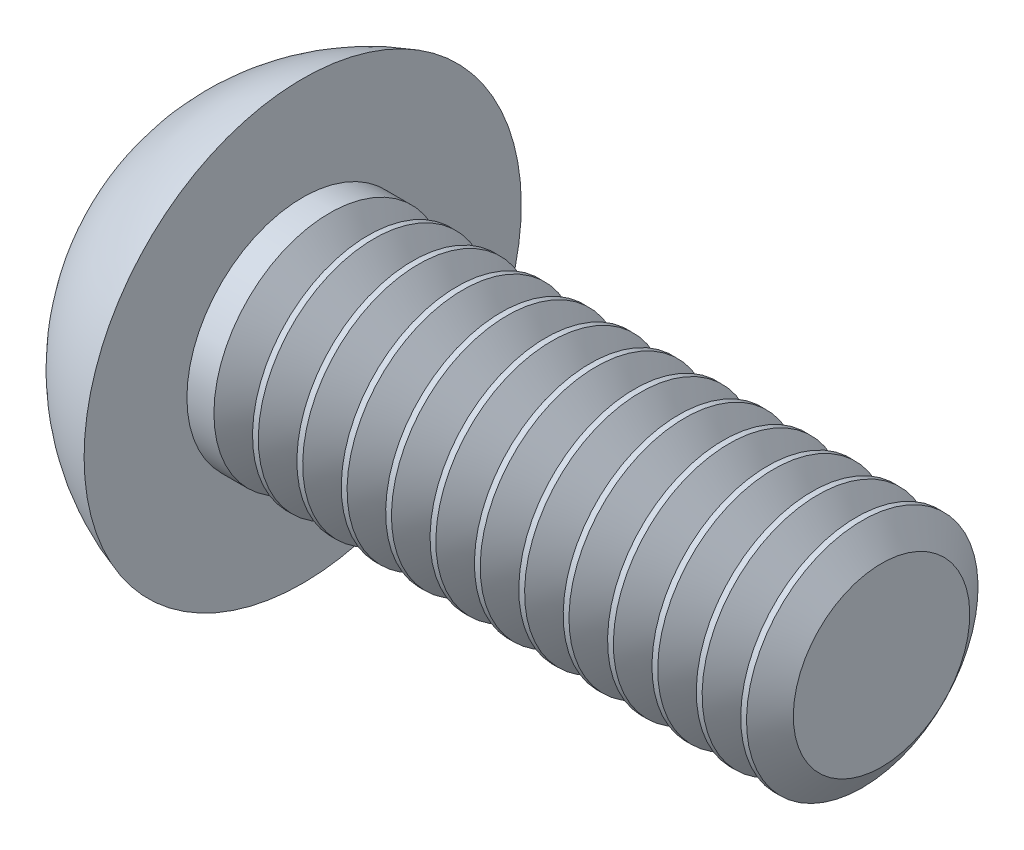
from build123d import *

# Parameters (mm, degrees)
CIRPATTERN1_COUNT = 2
CIRPATTERN1_ANGLE = 90
THDSCHPAT_COUNT   = 13
THDSCHPAT_PITCH   = 1.217083333


with BuildPart() as part:
    # BodySke → Base-Revolve (revolve)
    with BuildSketch(Plane.XY):
        with BuildLine():
            Line((20.32, 0), (20.32, 3.175))
            Line((20.32, 3.175), (4.445, 3.175))
            Line((4.445, 3.175), (4.445, 5.9944))
            ThreePointArc((4.445, 5.9944), (1.232493041, 3.73131533), (0, 0))
            Line((0, 0), (20.32, 0))
        make_face()
    revolve(axis=Axis((0, 0, 0), (1, 0, 0)))

    # Sketch3 → Cross section 0
    with BuildSketch(Plane(origin=(0, 0, 0), x_dir=(0, 0, -1), z_dir=(1, 0, 0))):
        with BuildLine():
            Line((0.6858, -3.8989), (-0.6858, -3.8989))
            Line((-0.6858, -3.8989), (-0.6858, 3.8989))
            Line((-0.6858, 3.8989), (0.6858, 3.8989))
            Line((0.6858, 3.8989), (0.6858, -3.8989))
        make_face()
    # Sketch4 → Cross section 1
    with BuildSketch(Plane(origin=(4.5974, 0, 0), x_dir=(0, 0, -1), z_dir=(1, 0, 0))):
        with BuildLine():
            Line((0.3429, -0.3429), (-0.3429, -0.3429))
            Line((-0.3429, -0.3429), (-0.3429, 0.3429))
            Line((-0.3429, 0.3429), (0.3429, 0.3429))
            Line((0.3429, 0.3429), (0.3429, -0.3429))
        make_face()
    cross = loft(mode=Mode.SUBTRACT)

    # CirPattern1: Cross ×2 about axis
    cirpattern1_axis = Axis((0, 0, 0), (1, 0, 0))
    for i in range(1, CIRPATTERN1_COUNT):
        add(cross.rotate(cirpattern1_axis, i * CIRPATTERN1_ANGLE / (CIRPATTERN1_COUNT - 1)), mode=Mode.SUBTRACT)

    # ThdSchSke → ThreadSchematic (revolve, cut)
    with BuildSketch(Plane.XY, mode=Mode.PRIVATE) as threadschematic_sk:
        Polygon((5.715, -2.41935), (5.185888174, -3.175), (5.185888174, -3.96875), (6.244111826, -3.96875), (6.244111826, -3.175), align=None)
    threadschematic = revolve(threadschematic_sk.sketch.rotate(Axis((-3.175, 0, 0), (1, 0, 0)), 270), axis=Axis((-3.175, 0, 0), (1, 0, 0)), mode=Mode.SUBTRACT)

    # ThdSchPat: ThreadSchematic ×13
    with Locations(*[(i * THDSCHPAT_PITCH, 0, 0) for i in range(1, THDSCHPAT_COUNT)]):
        add(threadschematic, mode=Mode.SUBTRACT)


solid = part.part
